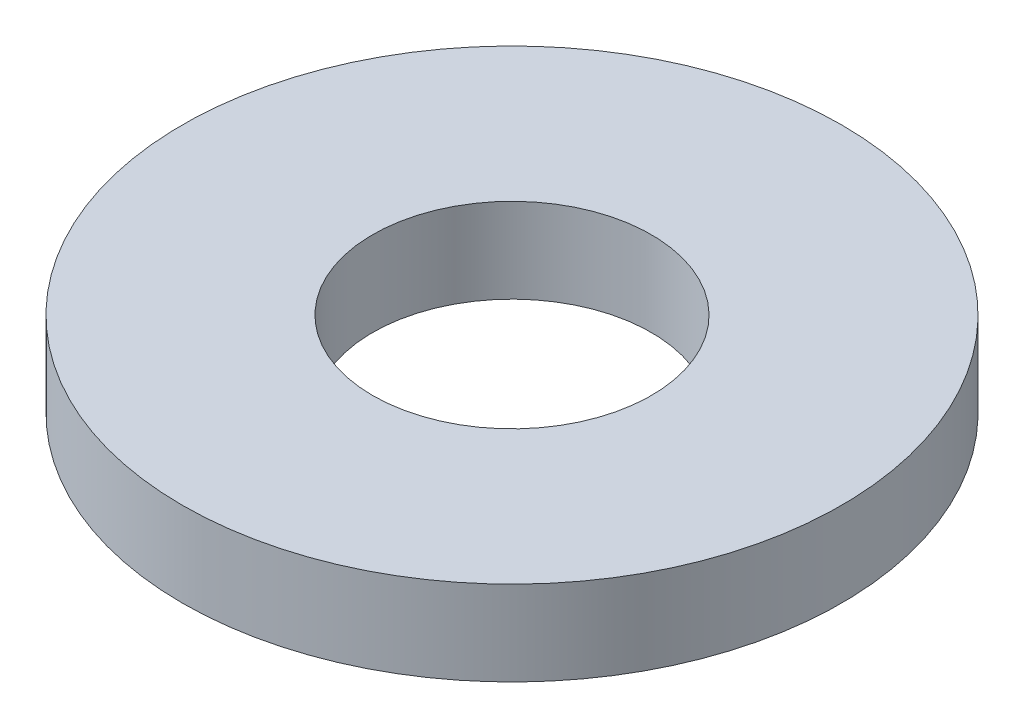
from build123d import *

# Parameters (mm, degrees)
SKETCH_2_R      = 35
SKETCH_2_R_2    = 14.8
EXTRUDE_1_DEPTH = 9


with BuildPart() as part:
    # Эскиз2 → Вытянуть1 (new body)
    with BuildSketch(Plane(origin=(0, 0, 0), x_dir=(1, 0, 0), z_dir=(0, 1, 0))):
        with Locations(Location((0, 0, 0), (0, 0, 270))):
            Circle(SKETCH_2_R)
        with Locations(Location((0, 0, 0), (0, 0, 270))):
            Circle(SKETCH_2_R_2, mode=Mode.SUBTRACT)
    extrude(amount=EXTRUDE_1_DEPTH)


solid = part.part
